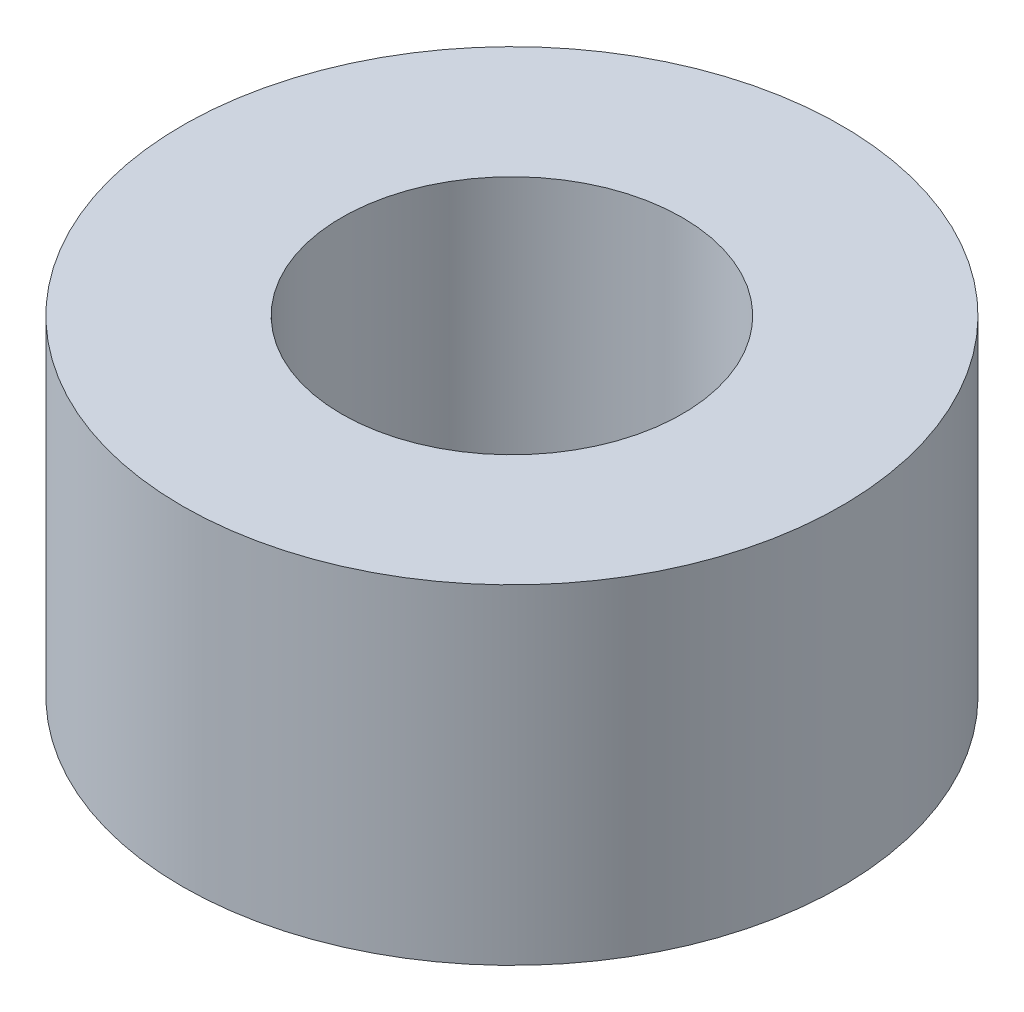
from build123d import *

# Parameters (mm, degrees)
SKETCH1_R           = 3
SKETCH1_R_2         = 1.55
BOSS_EXTRUDE1_DEPTH = 3


with BuildPart() as part:
    # Sketch1 → Boss-Extrude1 (new body)
    with BuildSketch(Plane(origin=(0, 0, 0), x_dir=(1, 0, 0), z_dir=(0, 1, 0))):
        with Locations(Location((0, 0, 0), (0, 0, 270))):
            Circle(SKETCH1_R)
        with Locations(Location((0, 0, 0), (0, 0, 270))):
            Circle(SKETCH1_R_2, mode=Mode.SUBTRACT)
    extrude(amount=BOSS_EXTRUDE1_DEPTH)


solid = part.part
